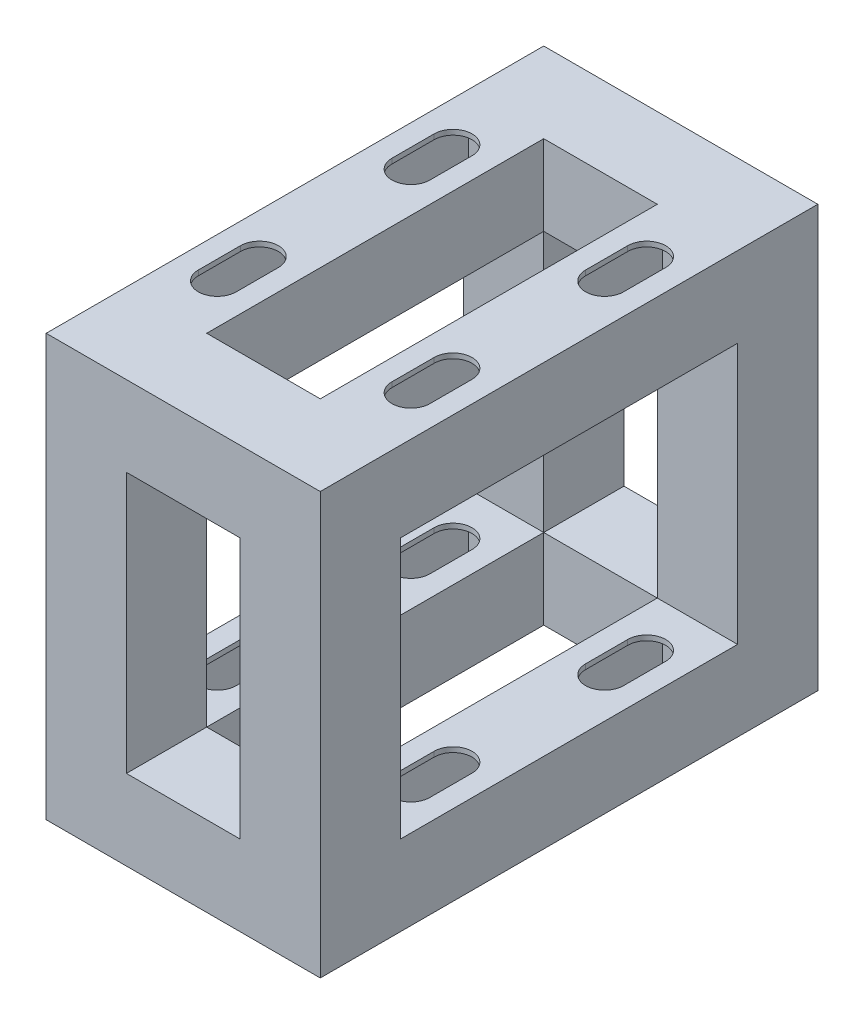
from build123d import *

# Parameters (mm, degrees)
SKETCH2_W          = 19.05
SKETCH2_H          = 19.05
SKETCH2_W_2        = 16.65
SKETCH2_H_2        = 16.65
CUT_EXTRUDE1_START = -9.525
SKETCH1_3_W        = 26.96
SKETCH1_3_H        = 80
CUT_EXTRUDE1_DEPTH = 19.05
SKETCH4_W          = 19.05
SKETCH4_H          = 19.05
SKETCH4_W_2        = 16.65
SKETCH4_H_2        = 16.65


with BuildPart() as part:
    # Sweep1: sweep along a path in Sketch1
    with BuildLine(Plane(origin=(0, 0, 0), x_dir=(1, 0, 0), z_dir=(0, 1, 0))) as sweep1_path:
        Line((13.48, 40), (-13.48, 40))
        Line((-13.48, 40), (-13.48, -40))
        Line((-13.48, -40), (13.48, -40))
        Line((13.48, -40), (13.48, 40))
    # Sketch2 → Sweep1 (sweep)
    with BuildSketch(Plane.XY):
        with Locations((-23.005, 0)):
            Rectangle(SKETCH2_W, SKETCH2_H)
        with Locations((-23.005, 0)):
            Rectangle(SKETCH2_W_2, SKETCH2_H_2, mode=Mode.SUBTRACT)
    sweep(path=sweep1_path.line, transition=Transition.RIGHT)

    # Sketch1<3> → Cut-Extrude1 (cut)
    with BuildSketch(Plane(origin=(0, 0, 0), x_dir=(1, 0, 0), z_dir=(0, 1, 0)).offset(CUT_EXTRUDE1_START)):
        Rectangle(SKETCH1_3_W, SKETCH1_3_H)
        with BuildLine():
            Line((-18.480970389, 27.980970389), (-18.480970389, 17.980970389))
            ThreePointArc((-18.480970389, 17.980970389), (-22.980970389, 13.480970389), (-27.480970389, 17.980970389))
            Line((-27.480970389, 17.980970389), (-27.480970389, 27.980970389))
            ThreePointArc((-27.480970389, 27.980970389), (-22.980970389, 32.480970389), (-18.480970389, 27.980970389))
        make_face()
        with BuildLine():
            Line((-18.480970389, -17.980970389), (-18.480970389, -27.980970389))
            ThreePointArc((-18.480970389, -27.980970389), (-22.980970389, -32.480970389), (-27.480970389, -27.980970389))
            Line((-27.480970389, -27.980970389), (-27.480970389, -17.980970389))
            ThreePointArc((-27.480970389, -17.980970389), (-22.980970389, -13.480970389), (-18.480970389, -17.980970389))
        make_face()
        with BuildLine():
            Line((27.480970389, 27.980970389), (27.480970389, 17.980970389))
            ThreePointArc((27.480970389, 17.980970389), (22.980970389, 13.480970389), (18.480970389, 17.980970389))
            Line((18.480970389, 17.980970389), (18.480970389, 27.980970389))
            ThreePointArc((18.480970389, 27.980970389), (22.980970389, 32.480970389), (27.480970389, 27.980970389))
        make_face()
        with BuildLine():
            Line((18.480970389, -27.980970389), (18.480970389, -17.980970389))
            ThreePointArc((18.480970389, -17.980970389), (22.980970389, -13.480970389), (27.480970389, -17.980970389))
            Line((27.480970389, -17.980970389), (27.480970389, -27.980970389))
            ThreePointArc((27.480970389, -27.980970389), (22.980970389, -32.480970389), (18.480970389, -27.980970389))
        make_face()
    extrude(amount=CUT_EXTRUDE1_DEPTH, mode=Mode.SUBTRACT)

    # Sweep2: sweep along a path in Sketch3
    with BuildLine(Plane(origin=(0, 0, 40), x_dir=(-1, 0, 0), z_dir=(0, 0, -1))) as sweep2_path:
        Line((13.48, 40.475), (13.48, 9.525))
        Line((13.48, 9.525), (-13.48, 9.525))
        Line((-13.48, 9.525), (-13.48, 40.475))
    # Sketch4 → Sweep2 (sweep)
    with BuildSketch(Plane(origin=(0, 9.525, 0), x_dir=(1, 0, 0), z_dir=(0, 1, 0))):
        with Locations((-23.005, -49.525)):
            Rectangle(SKETCH4_W, SKETCH4_H)
        with Locations((-23.005, -49.525)):
            Rectangle(SKETCH4_W_2, SKETCH4_H_2, mode=Mode.SUBTRACT)
    sweep2 = sweep(path=sweep2_path.line, transition=Transition.RIGHT)

    # Mirror1: Sweep2 across plane
    add(sweep2.mirror(Plane.XY))

    # Mirror3: part across plane


with BuildPart() as part_1:
    add(part.part)
    add(part.part.mirror(Plane.ZX.offset(40.475)))


solid = part_1.part
